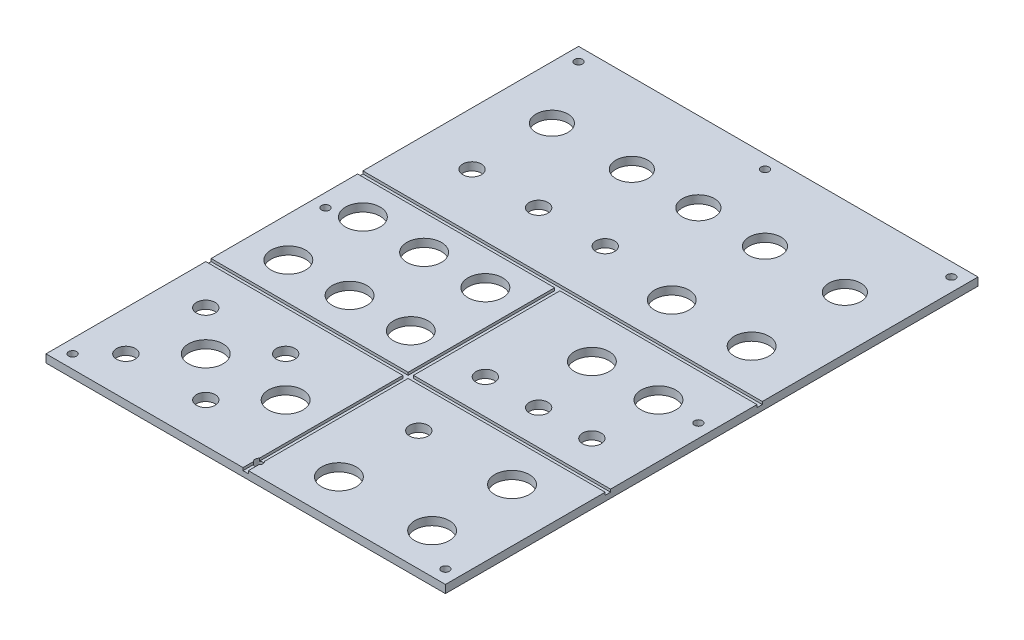
from build123d import *

# Parameters (mm, degrees)
SKETCH1_W           = 150
SKETCH1_H           = 200
BOSS_EXTRUDE1_DEPTH = 3
BUTTONS_R           = 6
BUTTONS_R_2         = 6.5
BUTTONS_R_3         = 3.5
CUT_EXTRUDE2_DEPTH  = 126.035994817
CUT_EXTRUDE3_DEPTH  = 1
BOXHOLES_R          = 1.5
BOX_HOLES_CUT_DEPTH = 126.035994817


with BuildPart() as part:
    # Sketch1 → Boss-Extrude1 (new body)
    with BuildSketch(Plane(origin=(0, 0, 0), x_dir=(1, 0, 0), z_dir=(0, 1, 0))):
        Rectangle(SKETCH1_W, SKETCH1_H)
    extrude(amount=BOSS_EXTRUDE1_DEPTH)

    # Buttons → Cut-Extrude2 (cut, through all)
    with BuildSketch(Plane(origin=(0, 3, 0), x_dir=(1, 0, 0), z_dir=(0, 1, 0))):
        with Locations(Location((-55, 70, 0), (0, 0, 270))):
            Circle(BUTTONS_R)
        with Locations(Location((-25, 70, 0), (0, 0, 270))):
            Circle(BUTTONS_R)
        with Locations(Location((0, 70, 0), (0, 0, 270))):
            Circle(BUTTONS_R)
        with Locations(Location((55, 70, 0), (0, 0, 270))):
            Circle(BUTTONS_R)
        with Locations(Location((55, 35, 0), (0, 0, 270))):
            Circle(BUTTONS_R_2)
        with Locations(Location((25, 35, 0), (0, 0, 270))):
            Circle(BUTTONS_R_2)
        with Locations(Location((55, -55, 0), (0, 0, 270))):
            Circle(BUTTONS_R_2)
        with Locations(Location((-55, 40, 0), (0, 0, 270))):
            Circle(BUTTONS_R_3)
        with Locations(Location((-5, 40, 0), (0, 0, 270))):
            Circle(BUTTONS_R_3)
        with Locations(Location((-30, 40, 0), (0, 0, 270))):
            Circle(BUTTONS_R_3)
        with Locations(Location((55, -85, 0), (0, 0, 270))):
            Circle(BUTTONS_R_2)
        with Locations(Location((20, -85, 0), (0, 0, 270))):
            Circle(BUTTONS_R_2)
        with Locations(Location((20, -55, 0), (0, 0, 270))):
            Circle(BUTTONS_R_3)
        with Locations(Location((-60, -55, 0), (0, 0, 270))):
            Circle(BUTTONS_R_3)
        with Locations(Location((-30, -55, 0), (0, 0, 270))):
            Circle(BUTTONS_R_3)
        with Locations(Location((-60, -85, 0), (0, 0, 270))):
            Circle(BUTTONS_R_3)
        with Locations(Location((-30, -85, 0), (0, 0, 270))):
            Circle(BUTTONS_R_3)
        with Locations(Location((-45, -70, 0), (0, 0, 270))):
            Circle(BUTTONS_R_2)
        with Locations(Location((30, 0, 0), (0, 0, 270))):
            Circle(BUTTONS_R_2)
        with Locations(Location((55, 0, 0), (0, 0, 270))):
            Circle(BUTTONS_R_2)
        with Locations(Location((35, -25, 0), (0, 0, 270))):
            Circle(BUTTONS_R_3)
        with Locations(Location((55, -25, 0), (0, 0, 270))):
            Circle(BUTTONS_R_3)
        with Locations(Location((15, -25, 0), (0, 0, 270))):
            Circle(BUTTONS_R_3)
        with Locations(Location((-60, 4, 0), (0, 0, 270))):
            Circle(BUTTONS_R_2)
        with Locations(Location((-37, 4, 0), (0, 0, 270))):
            Circle(BUTTONS_R_2)
        with Locations(Location((-14, 4, 0), (0, 0, 270))):
            Circle(BUTTONS_R_2)
        with Locations(Location((-60, -24, 0), (0, 0, 270))):
            Circle(BUTTONS_R_2)
        with Locations(Location((-37, -24, 0), (0, 0, 270))):
            Circle(BUTTONS_R_2)
        with Locations(Location((-14, -24, 0), (0, 0, 270))):
            Circle(BUTTONS_R_2)
        with Locations(Location((25, 70, 0), (0, 0, 270))):
            Circle(BUTTONS_R)
        with Locations(Location((-15, -70, 0), (0, 0, 270))):
            Circle(BUTTONS_R_2)
    extrude(amount=-CUT_EXTRUDE2_DEPTH, mode=Mode.SUBTRACT)

    # Sketch3 → Cut-Extrude3 (cut)
    with BuildSketch(Plane(origin=(0, 3, 0), x_dir=(1, 0, 0), z_dir=(0, 1, 0))):
        Polygon((75, -40), (1, -40), (1, -100), (-1, -100), (-1, -40), (-75, -40), (-75, -38), (-1, -38), (-1, 17), (-75, 17), (-75, 19), (75, 19), (75, 17), (1, 17), (1, -38), (75, -38), align=None)
    extrude(amount=-CUT_EXTRUDE3_DEPTH, mode=Mode.SUBTRACT)

    # BoxHoles → Box Holes Cut (cut, through all)
    with BuildSketch(Plane(origin=(0, 3, 0), x_dir=(1, 0, 0), z_dir=(0, 1, 0))):
        with Locations(Location((-70, 95, 0), (0, 0, 270))):
            Circle(BOXHOLES_R)
        with Locations(Location((70, 95, 0), (0, 0, 270))):
            Circle(BOXHOLES_R)
        with Locations(Location((70, 0, 0), (0, 0, 270))):
            Circle(BOXHOLES_R)
        with Locations(Location((-70, 0, 0), (0, 0, 270))):
            Circle(BOXHOLES_R)
        with Locations(Location((-70, -95, 0), (0, 0, 270))):
            Circle(BOXHOLES_R)
        with Locations(Location((70, -95, 0), (0, 0, 270))):
            Circle(BOXHOLES_R)
        with Locations(Location((0, 95, 0), (0, 0, 270))):
            Circle(BOXHOLES_R)
        with Locations(Location((0, -95, 0), (0, 0, 270))):
            Circle(BOXHOLES_R)
    extrude(amount=-BOX_HOLES_CUT_DEPTH, mode=Mode.SUBTRACT)


solid = part.part
